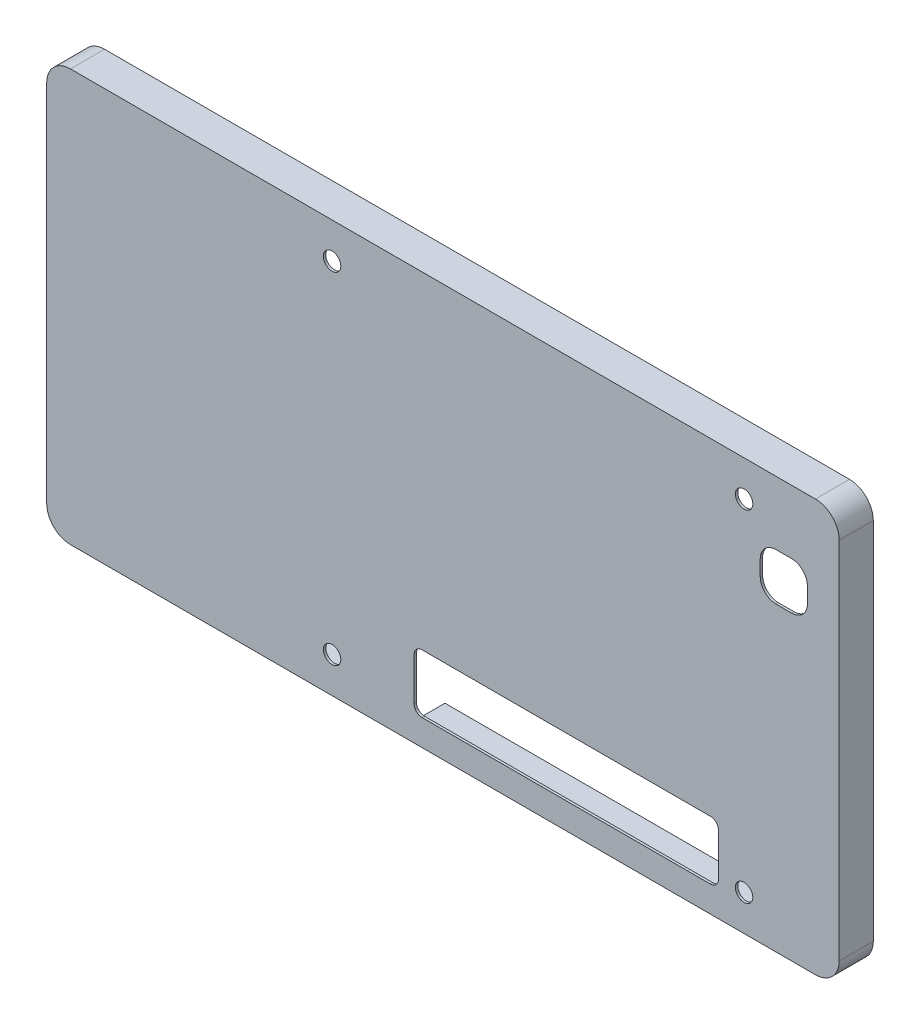
from build123d import *

# Parameters (mm, degrees)
SKETCH_1_W           = 99.974800609
SKETCH_1_H           = 51.97470409
EXTRUDE_1_DEPTH      = 8.6
SKETCH_2_W           = 95.974800609
SKETCH_2_H           = 47.97470409
CUT_EXTRUDE_1_DEPTH  = 4
SKETCH_3_W           = 2
SKETCH_3_H           = 10
SKETCH_3_H_2         = 9.97470409
CUT_EXTRUDE_2_DEPTH  = 3.35
SKETCH_4_R           = 1.1
SKETCH_4_W           = 38.392586289
SKETCH_4_H           = 7.4
SKETCH_4_W_2         = 5.95
SKETCH_4_H_2         = 5.95
CUT_EXTRUDE_3_DEPTH  = 1437.448457956
FILLET_1_R           = 3
FILLET_3_R           = 2
SKETCH_7_W           = 53.6
SKETCH_7_H           = 10.97470409
CUT_EXTRUDE_14_DEPTH = 4
FILLET_7_R           = 2
FILLET_8_R           = 1
SKETCH_14_W          = 2.323736835
SKETCH_14_H          = 6.8
CUT_EXTRUDE_15_DEPTH = 2
SKETCH_15_W          = 4.3
SKETCH_15_H          = 51.97470409
CUT_EXTRUDE_16_DEPTH = 1490.156636733
SKETCH_6_W           = 6.76
SKETCH_6_H           = 6.795709929
CUT_EXTRUDE_17_DEPTH = 4


with BuildPart() as part:
    # 草图1 → 凸台-拉伸1 (new body)
    with BuildSketch(Plane.XY.offset(1046.483288979)):
        with Locations((934.375963031, 1020.144466268)):
            Rectangle(SKETCH_1_W, SKETCH_1_H)
    extrude(amount=EXTRUDE_1_DEPTH)

    # 草图2 → 切除-拉伸1 (cut)
    with BuildSketch(Plane(origin=(0, 0, 1046.483288979), x_dir=(-1, 0, 0), z_dir=(0, 0, -1))):
        with Locations((-934.375963031, 1020.144466268)):
            Rectangle(SKETCH_2_W, SKETCH_2_H)
    extrude(amount=-CUT_EXTRUDE_1_DEPTH, mode=Mode.SUBTRACT)

    # 草图3 → 切除-拉伸2 (cut)
    with BuildSketch(Plane(origin=(0, 0, 1046.483288979), x_dir=(-1, 0, 0), z_dir=(0, 0, -1))):
        with Locations((-885.388562726, 1034.131818313)):
            Rectangle(SKETCH_3_W, SKETCH_3_H)
        with Locations((-885.388562726, 1020.144466268)):
            Rectangle(SKETCH_3_W, SKETCH_3_H_2)
        with Locations((-885.388562726, 1006.157114223)):
            Rectangle(SKETCH_3_W, SKETCH_3_H)
    extrude(amount=-CUT_EXTRUDE_2_DEPTH, mode=Mode.SUBTRACT)

    # 草图4 → 切除-拉伸3 (cut, through all)
    with BuildSketch(Plane(origin=(0, 0, 1050.483288979), x_dir=(-1, 0, 0), z_dir=(0, 0, -1))):
        with Locations((-920.388562726, 1041.631818313)):
            Circle(SKETCH_4_R)
        with Locations((-920.388562726, 998.657114223)):
            Circle(SKETCH_4_R)
        with Locations((-972.363363335, 998.657114223)):
            Circle(SKETCH_4_R)
        with Locations((-972.363363335, 1041.631818313)):
            Circle(SKETCH_4_R)
        with Locations((-949.933821712, 1001.144429438)):
            Rectangle(SKETCH_4_W, SKETCH_4_H)
        with Locations((-977.376048121, 1035.144495478)):
            Rectangle(SKETCH_4_W_2, SKETCH_4_H_2)
    extrude(amount=-CUT_EXTRUDE_3_DEPTH, mode=Mode.SUBTRACT)

    # 圆角1
    fillet_1_edges = [part.edges().sort_by_distance(p)[0] for p in [
        (884.388562726, 1046.131818313, 1050.783288979),
        (984.363363335, 1046.131818313, 1050.783288979),
        (984.363363335, 994.157114223, 1050.783288979),
        (884.388562726, 994.157114223, 1050.783288979),
    ]]
    fillet(fillet_1_edges, radius=FILLET_1_R)

    # 圆角3
    fillet_3_edges = [part.edges().sort_by_distance(p)[0] for p in [
        (980.351048121, 1032.169495478, 1052.783288979),
        (980.351048121, 1038.119495478, 1052.783288979),
        (974.401048121, 1038.119495478, 1052.783288979),
        (974.401048121, 1032.169495478, 1052.783288979),
    ]]
    fillet(fillet_3_edges, radius=FILLET_3_R)

    # 草图7 → 切除-拉伸14 (cut)
    with BuildSketch(Plane.XY.offset(1055.083288979)):
        Polygon((885.888562726, 1019.831818313), (982.863363335, 1019.831818313), (982.863363335, 1008.131818313), (927.763363335, 1008.131818313), (927.763363335, 1006.631818313), (927.763363335, 995.657114223), (885.888562726, 995.657114223), align=None)
        Polygon((934.163363335, 1044.631818313), (934.163363335, 1033.131818313), (935.663363335, 1033.131818313), (935.663363335, 1044.631818313), (982.863363335, 1044.631818313), (982.863363335, 1021.331818313), (963.463363335, 1021.331818313), (963.463363335, 1032.731818313), (943.963363335, 1032.731818313), (943.963363335, 1031.231818313), (961.963363335, 1031.231818313), (961.963363335, 1021.331818313), (927.563363335, 1021.331818313), (927.563363335, 1032.811818313), (904.363363335, 1032.811818313), (904.363363335, 1044.631818313), align=None)
        with Locations((956.063363335, 1001.144466268)):
            Rectangle(SKETCH_7_W, SKETCH_7_H)
        Polygon((926.063363335, 1021.331818313), (926.063363335, 1031.311818313), (902.863363335, 1031.311818313), (902.863363335, 1044.631818313), (885.888562726, 1044.631818313), (885.888562726, 1021.331818313), align=None)
    extrude(amount=-CUT_EXTRUDE_14_DEPTH, mode=Mode.SUBTRACT)

    # 圆角7
    fillet_7_edges = [part.edges().sort_by_distance(p)[0] for p in [
        (982.363363335, 996.157114223, 1048.483288979),
        (982.363363335, 1044.131818313, 1048.483288979),
        (886.388562726, 1044.131818313, 1048.483288979),
        (886.388562726, 996.157114223, 1048.483288979),
        (982.863363335, 995.657114223, 1053.083288979),
        (929.263363335, 995.657114223, 1053.083288979),
        (929.263363335, 1006.631818313, 1053.083288979),
        (982.863363335, 1006.631818313, 1053.083288979),
        (961.963363335, 1021.331818313, 1053.083288979),
        (927.563363335, 1021.331818313, 1053.083288979),
        (927.563363335, 1032.811818313, 1053.083288979),
        (904.363363335, 1032.811818313, 1053.083288979),
        (904.363363335, 1044.631818313, 1053.083288979),
        (934.163363335, 1044.631818313, 1053.083288979),
        (935.663363335, 1044.631818313, 1053.083288979),
        (982.863363335, 1044.631818313, 1053.083288979),
        (982.863363335, 1021.331818313, 1053.083288979),
        (963.463363335, 1021.331818313, 1053.083288979),
        (963.463363335, 1032.731818313, 1053.083288979),
        (961.963363335, 1031.231818313, 1053.083288979),
        (885.888562726, 1021.331818313, 1053.083288979),
        (885.888562726, 1044.631818313, 1053.083288979),
        (902.863363335, 1044.631818313, 1053.083288979),
        (902.863363335, 1031.311818313, 1053.083288979),
        (926.063363335, 1031.311818313, 1053.083288979),
        (926.063363335, 1021.331818313, 1053.083288979),
        (927.763363335, 995.657114223, 1053.083288979),
        (885.888562726, 995.657114223, 1053.083288979),
        (885.888562726, 1019.831818313, 1053.083288979),
        (982.863363335, 1019.831818313, 1053.083288979),
        (982.863363335, 1008.131818313, 1053.083288979),
        (927.763363335, 1008.131818313, 1053.083288979),
    ]]
    fillet(fillet_7_edges, radius=FILLET_7_R)

    # 圆角8
    fillet_8_edges = [part.edges().sort_by_distance(p)[0] for p in [
        (930.737528567, 997.444429438, 1050.783288979),
        (969.130114856, 997.444429438, 1050.783288979),
        (930.737528567, 1004.844429438, 1050.783288979),
        (969.130114856, 1004.844429438, 1050.783288979),
    ]]
    fillet(fillet_8_edges, radius=FILLET_8_R)

    # 草图14 → 切除-拉伸15 (cut)
    with BuildSketch(Plane.XY.offset(1055.083288979)):
        with Locations((983.201494917, 1013.231818313)):
            Rectangle(SKETCH_14_W, SKETCH_14_H)
    extrude(amount=-CUT_EXTRUDE_15_DEPTH, mode=Mode.SUBTRACT)

    # 草图15 → 切除-拉伸16 (cut, through all)
    with BuildSketch(Plane(origin=(984.363363335, 0, 0), x_dir=(0, 0, -1), z_dir=(1, 0, 0))):
        with Locations((-1052.933288979, 1020.144466268)):
            Rectangle(SKETCH_15_W, SKETCH_15_H)
    extrude(amount=-CUT_EXTRUDE_16_DEPTH, mode=Mode.SUBTRACT)

    # 草图6 → 切除-拉伸17 (cut)
    with BuildSketch(Plane(origin=(0, 0, 1046.483288979), x_dir=(-1, 0, 0), z_dir=(0, 0, -1))):
        with Locations((-926.946347841, 997.554969188)):
            Rectangle(SKETCH_6_W, SKETCH_6_H)
    extrude(amount=-CUT_EXTRUDE_17_DEPTH, mode=Mode.SUBTRACT)


solid = part.part
